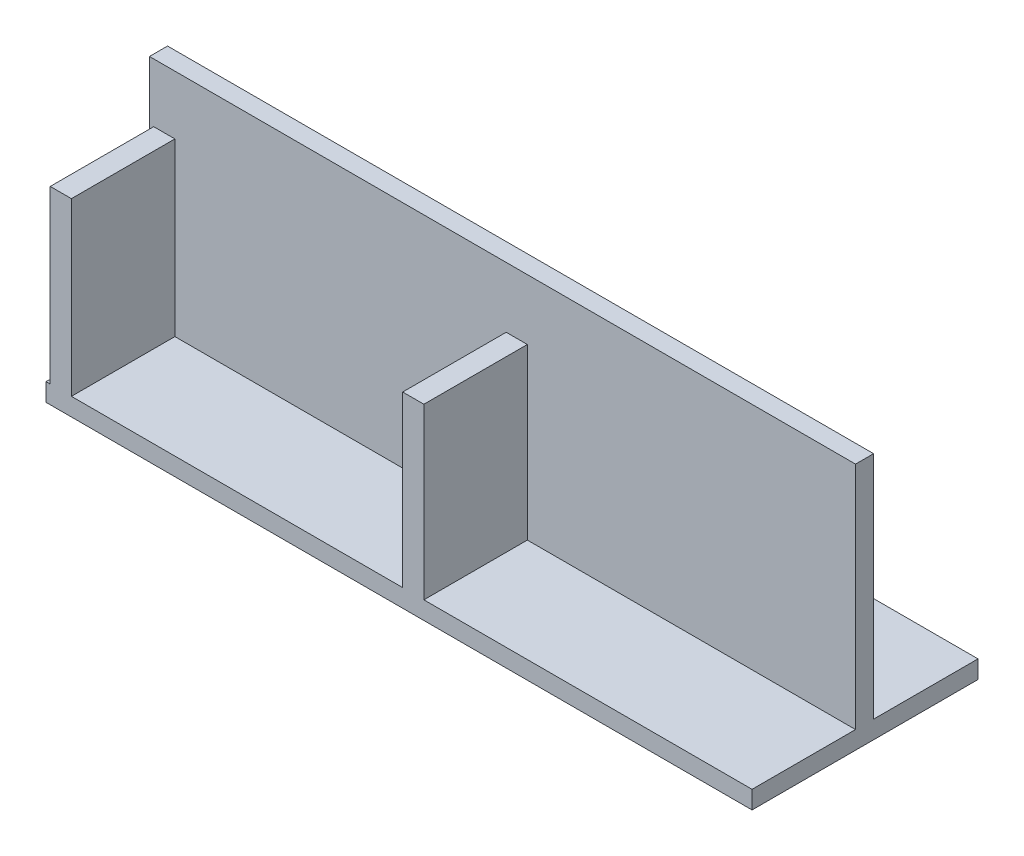
from build123d import *

# Parameters (mm, degrees)
SKETCH1_W           = 317.5
SKETCH1_H           = 101.6
BOSS_EXTRUDE1_DEPTH = 8.0518
BOSS_EXTRUDE2_START = 8.0518
SKETCH2_W           = 317.5
SKETCH2_H           = 8.128
BOSS_EXTRUDE2_DEPTH = 103.378
BOSS_EXTRUDE3_START = 8.0518
SKETCH3_W           = 9.525
SKETCH3_H           = 46.5328
BOSS_EXTRUDE3_DEPTH = 76.9874
BOSS_EXTRUDE4_START = 8.0518
SKETCH3_3_W         = 9.525
SKETCH3_3_H         = 46.5328
BOSS_EXTRUDE4_DEPTH = 76.1746


with BuildPart() as part:
    # Sketch1 → Boss-Extrude1 (new body)
    with BuildSketch(Plane(origin=(0, 0, 0), x_dir=(1, 0, 0), z_dir=(0, 1, 0))):
        with Locations((158.75, 50.8)):
            Rectangle(SKETCH1_W, SKETCH1_H)
    extrude(amount=BOSS_EXTRUDE1_DEPTH)

    # Sketch2 → Boss-Extrude2 (add)
    with BuildSketch(Plane(origin=(0, 0, 0), x_dir=(1, 0, 0), z_dir=(0, 1, 0)).offset(BOSS_EXTRUDE2_START)):
        with Locations((158.75, 50.5968)):
            Rectangle(SKETCH2_W, SKETCH2_H)
    extrude(amount=BOSS_EXTRUDE2_DEPTH)

    # Sketch3 → Boss-Extrude3 (add)
    with BuildSketch(Plane(origin=(0, 0, 0), x_dir=(1, 0, 0), z_dir=(0, 1, 0)).offset(BOSS_EXTRUDE3_START)):
        with Locations((6.6675, 23.2664)):
            Rectangle(SKETCH3_W, SKETCH3_H)
    extrude(amount=BOSS_EXTRUDE3_DEPTH)

    # Sketch3<3> → Boss-Extrude4 (add)
    with BuildSketch(Plane(origin=(0, 0, 0), x_dir=(1, 0, 0), z_dir=(0, 1, 0)).offset(BOSS_EXTRUDE4_START)):
        with Locations((165.1635, 23.2664)):
            Rectangle(SKETCH3_3_W, SKETCH3_3_H)
    extrude(amount=BOSS_EXTRUDE4_DEPTH)


solid = part.part
